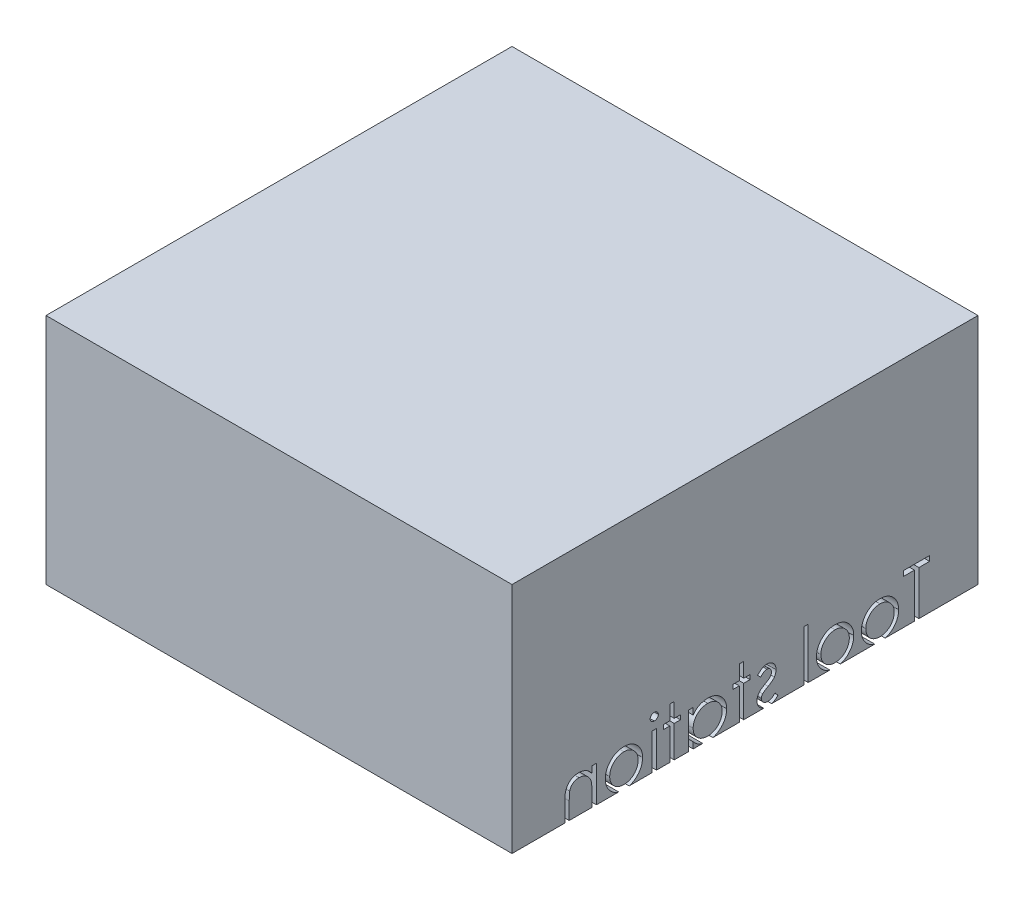
from build123d import *

# Parameters (mm, degrees)
SKETCH1_W           = 120
SKETCH1_H           = 60
BOSS_EXTRUDE1_DEPTH = 120
SKETCH2_W           = 1.13974359
SKETCH2_H           = 9.280769231
SKETCH2_H_2         = 13.025641026
CUT_EXTRUDE1_DEPTH  = 120


with BuildPart() as part:
    # Sketch1 → Boss-Extrude1 (new body)
    with BuildSketch(Plane(origin=(0, 0, 0), x_dir=(0, 0, -1), z_dir=(1, 0, 0))):
        Rectangle(SKETCH1_W, SKETCH1_H)
    extrude(amount=BOSS_EXTRUDE1_DEPTH)

    # Sketch2 → Cut-Extrude1 (cut)
    # profile 1 of 12: a face of its own
    with BuildSketch(Plane.ZY):
        with BuildLine():
            Line((38.262820513, -20.719230769), (39.402564103, -20.719230769))
            Line((39.402564103, -20.719230769), (39.402564103, -22.393229167))
            add(Edge.make_bspline(
                [(39.402564103, -22.393229167), (39.524257807, -22.241399858), (39.760408687, -21.946769788), (40.153688982, -21.55952656), (40.569319706, -21.240411029), (41.004755547, -20.986034405), (41.460587612, -20.794276648), (41.934037335, -20.655788841), (42.427939268, -20.572749606), (42.763815939, -20.561899341), (42.933733974, -20.556410256)],
                knots=[0, 0, 0, 0, 1.12780773, 2.188550248, 3.19190651, 4.159438251, 5.104880172, 6.052711206, 7.014878035, 8, 8, 8, 8], degree=3))
            add(Edge.make_bspline(
                [(42.933733974, -20.556410256), (43.105476561, -20.562742823), (43.44161823, -20.575137183), (43.93103291, -20.673169176), (44.388136367, -20.84061053), (44.811298755, -21.069980043), (45.192760358, -21.355209246), (45.527767676, -21.687505769), (45.804857173, -22.069725271), (45.990630462, -22.424320723), (46.113006384, -22.738877205), (46.190049437, -23.008286842), (46.255476141, -23.308435562), (46.312197055, -23.638416356), (46.350576861, -24.000541218), (46.380847462, -24.3933257), (46.402541581, -24.816642574), (46.403402304, -25.109419765), (46.403846154, -25.260396635)],
                knots=[0, 0, 0, 0, 1.235846778, 2.418850247, 3.575807741, 4.728682307, 5.871620074, 6.994088408, 8.11269785, 9.256955736, 9.865816715, 10.540099792, 11.271859618, 12.076849838, 12.949306005, 13.892391288, 14.913166135, 16, 16, 16, 16], degree=3))
            Line((46.403846154, -25.260396635), (46.403846154, -30))
            Line((46.403846154, -30), (45.264102564, -30))
            Line((45.264102564, -30), (45.264102564, -25.634375))
            add(Edge.make_bspline(
                [(45.264102564, -25.634375), (45.263401495, -25.508019271), (45.262060469, -25.266322266), (45.257830837, -24.920268954), (45.247635253, -24.606446226), (45.233308517, -24.32560435), (45.212338892, -24.078013001), (45.190485344, -23.863167911), (45.163761, -23.681341857), (45.139947001, -23.571885701), (45.129266827, -23.522796474)],
                knots=[0, 0, 0, 0, 1.430800155, 2.736877192, 3.918605307, 4.986035426, 5.920637409, 6.731861385, 7.431261377, 8, 8, 8, 8], degree=3))
            add(Edge.make_bspline(
                [(45.129266827, -23.522796474), (45.090711327, -23.378701603), (45.016503918, -23.101363558), (44.833137751, -22.725173765), (44.601583438, -22.40514034), (44.318925527, -22.14324195), (43.98789431, -21.939422057), (43.609408392, -21.798002279), (43.187120181, -21.709551245), (42.890105707, -21.700744223), (42.735296474, -21.696153846)],
                knots=[0, 0, 0, 0, 1.084156227, 2.086665306, 3.027808233, 3.945421172, 4.874247719, 5.839848303, 6.874090471, 8, 8, 8, 8], degree=3))
            add(Edge.make_bspline(
                [(42.735296474, -21.696153846), (42.64361088, -21.697881063), (42.462167456, -21.701299181), (42.193108987, -21.735593891), (41.932126987, -21.791686001), (41.676602229, -21.867409343), (41.431645377, -21.971412434), (41.189386378, -22.089447577), (40.958947548, -22.236579661), (40.735415221, -22.400557059), (40.527451605, -22.582273039), (40.33394592, -22.774023119), (40.161450818, -22.978223167), (40.005173053, -23.191582976), (39.870269069, -23.417032789), (39.752510721, -23.652397558), (39.652595485, -23.897987069), (39.602946858, -24.068439434), (39.578104968, -24.153725962)],
                knots=[0, 0, 0, 0, 1.023777757, 2.026029729, 3.023749952, 4.003683103, 4.997618607, 5.993177895, 7.010360494, 8.046726602, 9.087585522, 10.09234134, 11.086953743, 12.070360549, 13.043493632, 14.017870808, 15.008233677, 16, 16, 16, 16], degree=3))
            add(Edge.make_bspline(
                [(39.578104968, -24.153725962), (39.563809672, -24.216337698), (39.53268956, -24.352640174), (39.49907745, -24.576321353), (39.468569962, -24.835074691), (39.443035855, -25.128598241), (39.427413344, -25.457919674), (39.41037939, -25.821632571), (39.40417794, -26.221187229), (39.403117112, -26.499359657), (39.402564103, -26.644370994)],
                knots=[0, 0, 0, 0, 0.615963638, 1.340920617, 2.168419149, 3.115676021, 4.16674242, 5.331190069, 6.6087489, 8, 8, 8, 8], degree=3))
            Line((39.402564103, -26.644370994), (39.402564103, -30))
            Line((39.402564103, -30), (38.262820513, -30))
            Line((38.262820513, -30), (38.262820513, -20.719230769))
        make_face()
    # profile 2 of 12: a face of its own
    with BuildSketch(Plane.ZY):
        with BuildLine():
            add(Edge.make_bspline(
                [(31.185216346, -20.556410256), (31.359356108, -20.560118261), (31.700801622, -20.567388753), (32.20084738, -20.645094486), (32.678168301, -20.763920636), (33.134592484, -20.928191733), (33.564274471, -21.148380525), (33.973472985, -21.41112281), (34.361066132, -21.722391078), (34.593378266, -21.963176069), (34.711298077, -22.085396635)],
                knots=[0, 0, 0, 0, 1.054011418, 2.066658804, 3.057071809, 4.030435133, 4.997543892, 5.974964718, 6.972108034, 8, 8, 8, 8], degree=3))
            add(Edge.make_bspline(
                [(34.711298077, -22.085396635), (34.812832596, -22.202287383), (35.013936661, -22.433806722), (35.271803698, -22.809202803), (35.493950502, -23.197968311), (35.671978961, -23.605265754), (35.812350332, -24.02753956), (35.912011573, -24.466241144), (35.971291308, -24.920401661), (35.979284931, -25.228844159), (35.983333333, -25.38505609)],
                knots=[0, 0, 0, 0, 1.025258237, 2.030674902, 3.01204498, 3.988269485, 4.97094183, 5.956517959, 6.965070386, 8, 8, 8, 8], degree=3))
            add(Edge.make_bspline(
                [(35.983333333, -25.38505609), (35.979772481, -25.542173442), (35.97273607, -25.852644657), (35.906174948, -26.309914927), (35.802647865, -26.75330757), (35.654486623, -27.180966258), (35.464501484, -27.594198232), (35.232669561, -27.991198597), (34.957363978, -28.372750623), (34.645292333, -28.735614436), (34.300389811, -29.07004613), (33.926225501, -29.361522994), (33.530152293, -29.611246811), (33.106903554, -29.812401804), (32.660344388, -29.971005574), (32.189511598, -30.082402777), (31.695136628, -30.149755172), (31.357580711, -30.158404138), (31.185216346, -30.162820513)],
                knots=[0, 0, 0, 0, 0.998656419, 1.973391657, 2.932242238, 3.890759089, 4.846373663, 5.82037756, 6.809684879, 7.83454468, 8.860553229, 9.859544525, 10.845671541, 11.83227036, 12.833544569, 13.85385346, 14.904124723, 16, 16, 16, 16], degree=3))
            add(Edge.make_bspline(
                [(31.185216346, -30.162820513), (31.012007507, -30.158389315), (30.672769244, -30.149710591), (30.176649253, -30.08266445), (29.704972636, -29.971056914), (29.257828864, -29.811880583), (28.832760419, -29.611240381), (28.434392273, -29.362277965), (28.059924008, -29.069959687), (27.714948522, -28.735637858), (27.40289644, -28.372744588), (27.127585809, -27.991200163), (26.895755197, -27.594197824), (26.705769715, -27.180966367), (26.557608565, -26.75330754), (26.454081457, -26.309914935), (26.387520342, -25.852644655), (26.38048393, -25.542173441), (26.376923077, -25.38505609)],
                knots=[0, 0, 0, 0, 1.099876186, 2.154163076, 3.173186993, 4.173200201, 5.163417411, 6.152872554, 7.150605724, 8.17532212, 9.198891216, 10.186952605, 11.159729845, 12.11414092, 13.071450619, 14.029093627, 15.002601286, 16, 16, 16, 16], degree=3))
            add(Edge.make_bspline(
                [(26.376923077, -25.38505609), (26.380999089, -25.229693195), (26.389068892, -24.922101363), (26.448289025, -24.4687946), (26.547561501, -24.030835503), (26.68810114, -23.610191633), (26.867770547, -23.20467905), (27.086795791, -22.814952949), (27.347293229, -22.441254359), (27.547597454, -22.21003424), (27.648958333, -22.093028846)],
                knots=[0, 0, 0, 0, 1.031353054, 2.041901799, 3.029428768, 4.008703097, 4.981709435, 5.96992636, 6.972712378, 8, 8, 8, 8], degree=3))
            add(Edge.make_bspline(
                [(27.648958333, -22.093028846), (27.766700364, -21.969748352), (27.998260784, -21.727295569), (28.38778331, -21.416934696), (28.795975175, -21.148724942), (29.230405622, -20.932911246), (29.686454849, -20.762954339), (30.166221815, -20.644788041), (30.6679644, -20.567668724), (31.011080739, -20.560200479), (31.185216346, -20.556410256)],
                knots=[0, 0, 0, 0, 1.027980169, 2.021703884, 2.998553061, 3.971491411, 4.943284454, 5.930300938, 6.949603206, 8, 8, 8, 8], degree=3))
        make_face()
        with BuildLine():
            add(Edge.make_bspline(
                [(31.180128205, -21.696153846), (31.056983158, -21.699653936), (30.813872034, -21.706563761), (30.456023827, -21.759119644), (30.111526697, -21.842386302), (29.779727063, -21.960692449), (29.461743837, -22.11345131), (29.157272577, -22.301078789), (28.865417723, -22.521089802), (28.591888522, -22.773140068), (28.340855561, -23.04847242), (28.121406903, -23.341836465), (27.934807231, -23.648473778), (27.779358654, -23.96870323), (27.663581143, -24.305769989), (27.579496176, -24.655856851), (27.526989875, -25.019677077), (27.520145015, -25.2670042), (27.516666667, -25.392688301)],
                knots=[0, 0, 0, 0, 1.021534396, 2.016698045, 2.994645724, 3.958388632, 4.93408049, 5.916473867, 6.921342795, 7.962252576, 8.998418191, 10.008913653, 10.997312074, 11.973003931, 12.956656626, 13.948281152, 14.957379055, 16, 16, 16, 16], degree=3))
            add(Edge.make_bspline(
                [(27.516666667, -25.392688301), (27.522497141, -25.555074228), (27.534069542, -25.877379928), (27.6281774, -26.352037431), (27.785607616, -26.807720151), (27.998195745, -27.241756752), (28.264555453, -27.643339018), (28.578379952, -28.001375547), (28.93630115, -28.310478348), (29.334052451, -28.566948845), (29.763509547, -28.77072853), (30.218011055, -28.915141956), (30.692050145, -29.00901924), (31.016011655, -29.018350018), (31.180128205, -29.023076923)],
                knots=[0, 0, 0, 0, 1.016792936, 2.018143844, 3.017858371, 4.030088057, 5.03801393, 6.028138512, 7.003788237, 7.991172063, 8.984598303, 9.972568034, 10.972917682, 12, 12, 12, 12], degree=3))
            add(Edge.make_bspline(
                [(31.180128205, -29.023076923), (31.344235315, -29.018322478), (31.668178192, -29.008937334), (32.141558634, -28.91561476), (32.594817903, -28.770095762), (33.023828938, -28.567178029), (33.421399185, -28.30950441), (33.781894568, -28.003120985), (34.093039528, -27.642390724), (34.359135752, -27.241224834), (34.575205361, -26.808393042), (34.731898693, -26.351953328), (34.82623279, -25.877401347), (34.837774655, -25.555081404), (34.843589744, -25.392688301)],
                knots=[0, 0, 0, 0, 1.02726834, 2.027799167, 3.010890988, 4.004497153, 4.992059811, 5.971914811, 6.958719428, 7.966827853, 8.981595046, 9.981490638, 10.983022906, 12, 12, 12, 12], degree=3))
            add(Edge.make_bspline(
                [(34.843589744, -25.392688301), (34.840112592, -25.267003449), (34.83327009, -25.019674847), (34.780746647, -24.655865373), (34.696725118, -24.305738722), (34.580713821, -23.968818596), (34.425940685, -23.647644652), (34.235742607, -23.342736785), (34.017190029, -23.047456175), (33.763127905, -22.774030107), (33.489884219, -22.520991546), (33.197911081, -22.300993476), (32.893891301, -22.114275915), (32.576831873, -21.959385842), (32.244989699, -21.843462636), (31.900975259, -21.758638858), (31.544653863, -21.706785859), (31.302413906, -21.699720517), (31.180128205, -21.696153846)],
                knots=[0, 0, 0, 0, 1.042956736, 2.052379634, 3.044323526, 4.02829302, 5.004299113, 5.996692471, 7.007513377, 8.048758398, 9.090003419, 10.095195979, 11.07790575, 12.047570684, 13.018257071, 13.989683339, 14.985167495, 16, 16, 16, 16], degree=3))
        make_face(mode=Mode.SUBTRACT)
    # profile 3 of 12: a face of its own
    with BuildSketch(Plane.ZY):
        with BuildLine():
            add(Edge.make_bspline(
                [(23.359655449, -16.811538462), (23.43038108, -16.814819243), (23.568875451, -16.821243643), (23.769148165, -16.876258146), (23.951509323, -16.96951129), (24.113262811, -17.094623275), (24.252062514, -17.241759827), (24.349238234, -17.413249627), (24.411694643, -17.598519544), (24.419236829, -17.727751439), (24.423076923, -17.793549679)],
                knots=[0, 0, 0, 0, 1.055194115, 2.066272739, 3.074728998, 4.095836921, 5.109056067, 6.073838105, 7.019297344, 8, 8, 8, 8], degree=3))
            add(Edge.make_bspline(
                [(24.423076923, -17.793549679), (24.419150229, -17.857639878), (24.411387619, -17.984338616), (24.349286476, -18.166396643), (24.251234356, -18.335503615), (24.113351814, -18.482354477), (23.951485739, -18.607397299), (23.76915443, -18.70066878), (23.568873803, -18.755678421), (23.430380523, -18.762103492), (23.359655449, -18.765384615)],
                knots=[0, 0, 0, 0, 0.96129708, 1.900370562, 2.859976407, 3.87933698, 4.906634145, 5.921202961, 6.938410037, 8, 8, 8, 8], degree=3))
            add(Edge.make_bspline(
                [(23.359655449, -18.765384615), (23.289739136, -18.762228773), (23.153656168, -18.756086339), (22.956382197, -18.699589418), (22.775575964, -18.607365381), (22.613507009, -18.483173224), (22.478414594, -18.33460174), (22.380086385, -18.166499845), (22.318128666, -17.984312341), (22.310346728, -17.857631052), (22.306410256, -17.793549679)],
                knots=[0, 0, 0, 0, 1.054934014, 2.053291228, 3.073705704, 4.106921865, 5.123545215, 6.088680038, 7.033164197, 8, 8, 8, 8], degree=3))
            add(Edge.make_bspline(
                [(22.306410256, -17.793549679), (22.310260485, -17.727760597), (22.317822577, -17.598546687), (22.380132827, -17.41314471), (22.477595558, -17.242668975), (22.61359646, -17.09380502), (22.775552159, -16.969543014), (22.956388348, -16.877337453), (23.153654543, -16.820835735), (23.289738584, -16.814693963), (23.359655449, -16.811538462)],
                knots=[0, 0, 0, 0, 0.98631895, 1.937192651, 2.907499808, 3.917963147, 4.944918757, 5.95915025, 6.951458133, 8, 8, 8, 8], degree=3))
        make_face()
    # profile 4 of 12: a face of its own
    with BuildSketch(Plane.ZY):
        with Locations((23.36474359, -25.359615385)):
            Rectangle(SKETCH2_W, SKETCH2_H)
    # profile 5 of 12: a face of its own
    with BuildSketch(Plane.ZY):
        Polygon((18.235897436, -16.974358974), (19.375641026, -16.974358974), (19.375641026, -20.719230769), (21.003846154, -20.719230769), (21.003846154, -21.858974359), (19.375641026, -21.858974359), (19.375641026, -30), (18.235897436, -30), (18.235897436, -21.858974359), (16.607692308, -21.858974359), (16.607692308, -20.719230769), (18.235897436, -20.719230769), align=None)
    # profile 6 of 12: a face of its own
    with BuildSketch(Plane.ZY):
        with BuildLine():
            Line((14.491025641, -20.719230769), (14.491025641, -30))
            Line((14.491025641, -30), (13.351282051, -30))
            Line((13.351282051, -30), (13.351282051, -28.394691506))
            add(Edge.make_bspline(
                [(13.351282051, -28.394691506), (13.22276244, -28.539978033), (12.971954801, -28.823506517), (12.553068459, -29.193918971), (12.109046785, -29.500091738), (11.642044848, -29.747378575), (11.152484365, -29.933132608), (10.641450563, -30.065162385), (10.108734981, -30.150048587), (9.744962151, -30.158525009), (9.560616987, -30.162820513)],
                knots=[0, 0, 0, 0, 1.074387032, 2.096679803, 3.090159297, 4.057316773, 5.018401886, 5.985159533, 6.978961417, 8, 8, 8, 8], degree=3))
            add(Edge.make_bspline(
                [(9.560616987, -30.162820513), (9.39672184, -30.158370533), (9.073513354, -30.149594977), (8.598064988, -30.081514618), (8.140530255, -29.972183505), (7.700476805, -29.820143135), (7.280752163, -29.618464154), (6.87776267, -29.377014482), (6.493596044, -29.08948347), (6.134107889, -28.760778339), (5.803066059, -28.403745099), (5.512558012, -28.022942687), (5.270339694, -27.620017755), (5.067792544, -27.20007174), (4.911777237, -26.759871889), (4.803015764, -26.300940451), (4.735014715, -25.823820053), (4.726242786, -25.498919497), (4.721794872, -25.334174679)],
                knots=[0, 0, 0, 0, 1.033919861, 2.038935746, 3.024066025, 3.998881131, 4.97069526, 5.957263378, 6.95902576, 7.993208707, 9.027059324, 10.027763471, 11.009749337, 11.988697705, 12.965288445, 13.950418724, 14.960734635, 16, 16, 16, 16], degree=3))
            add(Edge.make_bspline(
                [(4.721794872, -25.334174679), (4.726341368, -25.172834955), (4.735329546, -24.853875024), (4.802288372, -24.384778034), (4.914886603, -23.932954631), (5.072903079, -23.499859437), (5.275529601, -23.084968397), (5.522011517, -22.687988078), (5.812366627, -22.307824836), (6.147111075, -21.953417813), (6.509731527, -21.62604587), (6.897657493, -21.341533048), (7.301239114, -21.095817625), (7.726736324, -20.901132154), (8.167851247, -20.743619117), (8.628510893, -20.634642347), (9.106798621, -20.570426353), (9.431521264, -20.56112718), (9.596233974, -20.556410256)],
                knots=[0, 0, 0, 0, 1.020392517, 2.01726096, 2.990465484, 3.961182959, 4.928053699, 5.906110375, 6.912531644, 7.948652711, 8.985773172, 9.998621852, 10.987621588, 11.969261332, 12.953316658, 13.946091881, 14.958173133, 16, 16, 16, 16], degree=3))
            add(Edge.make_bspline(
                [(9.596233974, -20.556410256), (9.785644892, -20.561627241), (10.157070761, -20.5718575), (10.700369537, -20.656993682), (11.214336643, -20.800824692), (11.702939577, -20.996468185), (12.164423781, -21.256450716), (12.594420324, -21.58440086), (12.997429363, -21.97825031), (13.23103785, -22.280765923), (13.351282051, -22.436478365)],
                knots=[0, 0, 0, 0, 1.038897134, 2.037228247, 3.008116434, 3.962042015, 4.918381754, 5.904844433, 6.921570401, 8, 8, 8, 8], degree=3))
            Line((13.351282051, -22.436478365), (13.351282051, -20.719230769))
            Line((13.351282051, -20.719230769), (14.491025641, -20.719230769))
        make_face()
        with BuildLine():
            add(Edge.make_bspline(
                [(9.611498397, -21.696153846), (9.444894943, -21.702081617), (9.116046223, -21.713782095), (8.633286558, -21.80512592), (8.171320742, -21.957107163), (7.732459272, -22.164958633), (7.3236346, -22.426320048), (6.958260423, -22.742446211), (6.633348336, -23.104711948), (6.36008692, -23.511482462), (6.137327116, -23.94755725), (5.980692458, -24.403394497), (5.87738976, -24.870772558), (5.866835985, -25.187774304), (5.861538462, -25.346895032)],
                knots=[0, 0, 0, 0, 1.031046209, 2.035121221, 3.029706178, 4.034933723, 5.034054252, 6.02443088, 7.017295772, 8.038157696, 9.050218397, 10.03989886, 11.016116709, 12, 12, 12, 12], degree=3))
            add(Edge.make_bspline(
                [(5.861538462, -25.346895032), (5.86830536, -25.50506485), (5.881812633, -25.820784512), (5.978879439, -26.288799748), (6.141729265, -26.744744415), (6.363950464, -27.184748591), (6.64221336, -27.593268041), (6.964752185, -27.962439343), (7.334686063, -28.279901563), (7.744451588, -28.545649331), (8.182086224, -28.760324763), (8.642312204, -28.909697227), (9.116478091, -29.006136602), (9.438885131, -29.017401418), (9.601322115, -29.023076923)],
                knots=[0, 0, 0, 0, 0.979072187, 1.954306742, 2.945804271, 3.96968567, 4.997920485, 5.998718438, 6.996577872, 8.005894225, 9.015743152, 10.005417472, 10.995077863, 12, 12, 12, 12], degree=3))
            add(Edge.make_bspline(
                [(9.601322115, -29.023076923), (9.766227997, -29.017053625), (10.094209439, -29.005073884), (10.578401322, -28.913339007), (11.048283044, -28.761777939), (11.497453845, -28.551686822), (11.915886663, -28.29131013), (12.291436105, -27.9864844), (12.608994047, -27.631961417), (12.878207231, -27.242338288), (13.089300885, -26.815211901), (13.243065443, -26.360427837), (13.33397533, -25.877970265), (13.345433377, -25.548264016), (13.351282051, -25.379967949)],
                knots=[0, 0, 0, 0, 1.01762866, 2.023962475, 3.030623092, 4.058876274, 5.077231937, 6.066672613, 7.034107872, 8.005628644, 8.981990164, 9.965428785, 10.961468474, 12, 12, 12, 12], degree=3))
            add(Edge.make_bspline(
                [(13.351282051, -25.379967949), (13.34779987, -25.251742107), (13.340945834, -24.999353071), (13.288583482, -24.628776079), (13.205289892, -24.274142273), (13.087919503, -23.935078801), (12.933736843, -23.613460317), (12.747780664, -23.30697753), (12.526780889, -23.017224449), (12.274295106, -22.74819102), (11.997924228, -22.502803571), (11.705481181, -22.283767612), (11.393501156, -22.103831208), (11.067230765, -21.954910023), (10.726103923, -21.836403964), (10.367344816, -21.757345761), (9.994766778, -21.703061168), (9.740599663, -21.698480529), (9.611498397, -21.696153846)],
                knots=[0, 0, 0, 0, 1.050140795, 2.067009409, 3.05949893, 4.030605086, 5.00011959, 5.97591094, 6.962425594, 7.979863591, 8.993523472, 9.986985069, 10.967611495, 11.937549037, 12.921786183, 13.919465291, 14.943216303, 16, 16, 16, 16], degree=3))
        make_face(mode=Mode.SUBTRACT)
    # profile 7 of 12: a face of its own
    with BuildSketch(Plane.ZY):
        Polygon((0.325641026, -16.974358974), (1.465384615, -16.974358974), (1.465384615, -20.719230769), (3.093589744, -20.719230769), (3.093589744, -21.858974359), (1.465384615, -21.858974359), (1.465384615, -30), (0.325641026, -30), (0.325641026, -21.858974359), (-1.302564103, -21.858974359), (-1.302564103, -20.719230769), (0.325641026, -20.719230769), align=None)
    # profile 8 of 12: a face of its own
    with BuildSketch(Plane.ZY):
        with BuildLine():
            Line((-3.256410256, -21.876782853), (-4.029807692, -22.673076923))
            add(Edge.make_bspline(
                [(-4.029807692, -22.673076923), (-4.096538948, -22.595740649), (-4.225188953, -22.446645418), (-4.429228898, -22.247302348), (-4.632514546, -22.079891169), (-4.832263098, -21.938550116), (-5.033497388, -21.831691784), (-5.23385592, -21.753696142), (-5.433546142, -21.70542959), (-5.567026899, -21.699208626), (-5.632572115, -21.696153846)],
                knots=[0, 0, 0, 0, 1.26578478, 2.440284043, 3.530471711, 4.527705817, 5.468200915, 6.346673037, 7.188140097, 8, 8, 8, 8], degree=3))
            add(Edge.make_bspline(
                [(-5.632572115, -21.696153846), (-5.712906473, -21.7000541), (-5.870993119, -21.707729246), (-6.09750966, -21.784340836), (-6.307787642, -21.901938259), (-6.489785827, -22.068738548), (-6.643955408, -22.260197466), (-6.756490765, -22.474269845), (-6.825310191, -22.704495603), (-6.834035933, -22.864261087), (-6.838461538, -22.945292468)],
                knots=[0, 0, 0, 0, 0.99966794, 1.967205029, 2.953328237, 3.988086729, 5.028030931, 6.008226631, 6.989793394, 8, 8, 8, 8], degree=3))
            add(Edge.make_bspline(
                [(-6.838461538, -22.945292468), (-6.834430877, -23.018633314), (-6.826380916, -23.165108259), (-6.763800108, -23.381182553), (-6.664137504, -23.591846663), (-6.57099137, -23.720889209), (-6.522996795, -23.787379808)],
                knots=[0, 0, 0, 0, 0.960159726, 1.917612774, 2.927026955, 4, 4, 4, 4], degree=3))
            add(Edge.make_bspline(
                [(-6.522996795, -23.787379808), (-6.494100689, -23.822883871), (-6.432598969, -23.898449795), (-6.317179501, -24.003329491), (-6.186469276, -24.11923423), (-6.029279788, -24.235119325), (-5.852383201, -24.357154442), (-5.651943512, -24.48053361), (-5.434321737, -24.614661666), (-5.278520653, -24.699731475), (-5.197536058, -24.743950321)],
                knots=[0, 0, 0, 0, 0.66740084, 1.420478572, 2.27185888, 3.217733974, 4.268547843, 5.408967954, 6.65319498, 8, 8, 8, 8], degree=3))
            add(Edge.make_bspline(
                [(-5.197536058, -24.743950321), (-5.098789649, -24.799267539), (-4.908044104, -24.906122191), (-4.637016063, -25.071983115), (-4.391045942, -25.236834283), (-4.168049663, -25.398912677), (-3.972317956, -25.562753082), (-3.797912294, -25.722075515), (-3.649182797, -25.881693862), (-3.565892835, -25.99321116), (-3.526081731, -26.046514423)],
                knots=[0, 0, 0, 0, 1.27191281, 2.456916733, 3.569705269, 4.599008579, 5.553216877, 6.436649441, 7.252746552, 8, 8, 8, 8], degree=3))
            add(Edge.make_bspline(
                [(-3.526081731, -26.046514423), (-3.460003531, -26.154159943), (-3.328495651, -26.368394505), (-3.190398512, -26.721158513), (-3.110351229, -27.095302336), (-3.099239744, -27.351233535), (-3.093589744, -27.481370192)],
                knots=[0, 0, 0, 0, 0.995354457, 1.980940102, 2.973342416, 4, 4, 4, 4], degree=3))
            add(Edge.make_bspline(
                [(-3.093589744, -27.481370192), (-3.096200623, -27.573061094), (-3.101345647, -27.753748033), (-3.137116347, -28.019848701), (-3.19863869, -28.274336953), (-3.282436026, -28.519974129), (-3.39559075, -28.75205371), (-3.528207043, -28.976430956), (-3.687410294, -29.188252191), (-3.869170428, -29.387239275), (-4.068181221, -29.568978987), (-4.280474923, -29.728723048), (-4.506312965, -29.861435643), (-4.744081645, -29.97125561), (-4.99432119, -30.058589003), (-5.257070725, -30.119050188), (-5.531495063, -30.155237064), (-5.718111795, -30.160260735), (-5.813201122, -30.162820513)],
                knots=[0, 0, 0, 0, 1.032770009, 2.035186124, 3.017557409, 3.978232242, 4.952395191, 5.920591857, 6.910227898, 7.931268572, 8.952309245, 9.941945286, 10.918353717, 11.897095711, 12.887975737, 13.898235213, 14.929059601, 16, 16, 16, 16], degree=3))
            add(Edge.make_bspline(
                [(-5.813201122, -30.162820513), (-5.941533444, -30.159218429), (-6.196414922, -30.152064311), (-6.573386188, -30.084913747), (-6.941761513, -29.980427603), (-7.298753216, -29.836315499), (-7.636377687, -29.654340055), (-7.945281327, -29.43639937), (-8.226537205, -29.189692808), (-8.386623513, -29.000597389), (-8.466666667, -28.906049679)],
                knots=[0, 0, 0, 0, 1.013940152, 2.01379169, 3.017749504, 4.037548394, 5.051665909, 6.043208538, 7.021604269, 8, 8, 8, 8], degree=3))
            Line((-8.466666667, -28.906049679), (-7.711077724, -28.046153846))
            add(Edge.make_bspline(
                [(-7.711077724, -28.046153846), (-7.639332112, -28.123641135), (-7.500242393, -28.27386196), (-7.277806549, -28.473884567), (-7.051458437, -28.64152918), (-6.823458288, -28.78174957), (-6.590431089, -28.889791748), (-6.353682717, -28.96569636), (-6.113694721, -29.014479571), (-5.952505828, -29.020206482), (-5.871714744, -29.023076923)],
                knots=[0, 0, 0, 0, 1.179806542, 2.287233372, 3.337373186, 4.324005949, 5.273901747, 6.200048787, 7.097828587, 8, 8, 8, 8], degree=3))
            add(Edge.make_bspline(
                [(-5.871714744, -29.023076923), (-5.761703984, -29.018102787), (-5.546761413, -29.00838416), (-5.238899774, -28.920147855), (-4.954642473, -28.781790601), (-4.707814905, -28.58554041), (-4.497712777, -28.357101618), (-4.345573402, -28.099784671), (-4.250228422, -27.821141385), (-4.239030656, -27.627984173), (-4.233333333, -27.529707532)],
                knots=[0, 0, 0, 0, 1.072336372, 2.095165389, 3.102688358, 4.141489647, 5.156069229, 6.117746104, 7.042326257, 8, 8, 8, 8], degree=3))
            add(Edge.make_bspline(
                [(-4.233333333, -27.529707532), (-4.23727503, -27.448755487), (-4.245057382, -27.288926511), (-4.306174398, -27.057603845), (-4.402741033, -26.838186741), (-4.497826471, -26.709772878), (-4.546254006, -26.644370994)],
                knots=[0, 0, 0, 0, 1.013901739, 2.00181326, 2.98231254, 4, 4, 4, 4], degree=3))
            add(Edge.make_bspline(
                [(-4.546254006, -26.644370994), (-4.575363838, -26.611585537), (-4.638775563, -26.54016697), (-4.755090296, -26.437024541), (-4.894361625, -26.32585201), (-5.05815593, -26.20853453), (-5.246803406, -26.086619591), (-5.461068645, -25.960746799), (-5.698016365, -25.824937622), (-5.865549798, -25.73487773), (-5.953125, -25.687800481)],
                knots=[0, 0, 0, 0, 0.615000592, 1.339693406, 2.178160186, 3.116406724, 4.166410947, 5.330106347, 6.604359322, 8, 8, 8, 8], degree=3))
            add(Edge.make_bspline(
                [(-5.953125, -25.687800481), (-6.047637094, -25.635044203), (-6.230926206, -25.532732944), (-6.490540662, -25.37338031), (-6.724755347, -25.211301913), (-6.939206003, -25.055589611), (-7.128475938, -24.898033614), (-7.291819522, -24.738459016), (-7.435667762, -24.583301352), (-7.515305514, -24.473365447), (-7.553345353, -24.420853365)],
                knots=[0, 0, 0, 0, 1.262093308, 2.447601706, 3.550203992, 4.582594899, 5.537233252, 6.418365656, 7.244515135, 8, 8, 8, 8], degree=3))
            add(Edge.make_bspline(
                [(-7.553345353, -24.420853365), (-7.619133528, -24.315096419), (-7.750732871, -24.10354557), (-7.878513707, -23.750447554), (-7.966347012, -23.378718346), (-7.974193399, -23.122226046), (-7.978205128, -22.991085737)],
                knots=[0, 0, 0, 0, 0.985009483, 1.970363186, 2.962279964, 4, 4, 4, 4], degree=3))
            add(Edge.make_bspline(
                [(-7.978205128, -22.991085737), (-7.976266762, -22.905359293), (-7.972473106, -22.737580497), (-7.942196119, -22.491059635), (-7.887071909, -22.256842048), (-7.817929762, -22.031410288), (-7.721834288, -21.819131261), (-7.607004861, -21.617174152), (-7.472067634, -21.425818106), (-7.316607692, -21.248006741), (-7.145677865, -21.086501471), (-6.961002558, -20.945717879), (-6.76673517, -20.825589105), (-6.56205319, -20.724841237), (-6.344990331, -20.64863622), (-6.117063844, -20.596176566), (-5.878735082, -20.561141973), (-5.715808139, -20.55801021), (-5.632572115, -20.556410256)],
                knots=[0, 0, 0, 0, 1.087655834, 2.128696564, 3.144119009, 4.137814668, 5.115653402, 6.093965665, 7.082169637, 8.081268856, 9.086088321, 10.061021666, 11.022561449, 11.980240094, 12.950172527, 13.934149372, 14.944599409, 16, 16, 16, 16], degree=3))
            add(Edge.make_bspline(
                [(-5.632572115, -20.556410256), (-5.533903771, -20.560417436), (-5.334716166, -20.568506964), (-5.035886523, -20.632753327), (-4.737496967, -20.738464876), (-4.438780812, -20.884464923), (-4.141926333, -21.073393301), (-3.84432231, -21.301736759), (-3.542396029, -21.567993037), (-3.353868836, -21.771553084), (-3.256410256, -21.876782853)],
                knots=[0, 0, 0, 0, 0.845714091, 1.707292901, 2.609013841, 3.555613372, 4.552488639, 5.621697636, 6.770543573, 8, 8, 8, 8], degree=3))
        make_face()
    # profile 9 of 12: a face of its own
    with BuildSketch(Plane.ZY):
        with Locations((-15.712179487, -23.487179487)):
            Rectangle(SKETCH2_W, SKETCH2_H_2)
    # profile 10 of 12: a face of its own
    with BuildSketch(Plane.ZY):
        with BuildLine():
            add(Edge.make_bspline(
                [(-23.196834936, -20.556410256), (-23.022695174, -20.560118261), (-22.68124966, -20.567388753), (-22.181203902, -20.645094486), (-21.703882981, -20.763920636), (-21.247458798, -20.928191733), (-20.817776811, -21.148380525), (-20.408578297, -21.41112281), (-20.02098515, -21.722391078), (-19.788673016, -21.963176069), (-19.670753205, -22.085396635)],
                knots=[0, 0, 0, 0, 1.054011418, 2.066658804, 3.057071809, 4.030435133, 4.997543892, 5.974964718, 6.972108034, 8, 8, 8, 8], degree=3))
            add(Edge.make_bspline(
                [(-19.670753205, -22.085396635), (-19.569218686, -22.202287383), (-19.368114621, -22.433806722), (-19.110247584, -22.809202803), (-18.88810078, -23.197968311), (-18.710072321, -23.605265754), (-18.56970095, -24.02753956), (-18.470039709, -24.466241144), (-18.410759974, -24.920401661), (-18.402766351, -25.228844159), (-18.398717949, -25.38505609)],
                knots=[0, 0, 0, 0, 1.025258237, 2.030674902, 3.01204498, 3.988269485, 4.97094183, 5.956517959, 6.965070386, 8, 8, 8, 8], degree=3))
            add(Edge.make_bspline(
                [(-18.398717949, -25.38505609), (-18.402278801, -25.542173442), (-18.409315212, -25.852644657), (-18.475876334, -26.309914927), (-18.579403417, -26.75330757), (-18.727564659, -27.180966258), (-18.917549798, -27.594198232), (-19.149381721, -27.991198597), (-19.424687304, -28.372750623), (-19.736758949, -28.735614436), (-20.081661471, -29.07004613), (-20.455825781, -29.361522994), (-20.851898989, -29.611246811), (-21.275147728, -29.812401804), (-21.721706894, -29.971005574), (-22.192539684, -30.082402777), (-22.686914654, -30.149755172), (-23.024470571, -30.158404138), (-23.196834936, -30.162820513)],
                knots=[0, 0, 0, 0, 0.998656419, 1.973391657, 2.932242238, 3.890759089, 4.846373663, 5.82037756, 6.809684879, 7.83454468, 8.860553229, 9.859544525, 10.845671541, 11.83227036, 12.833544569, 13.85385346, 14.904124723, 16, 16, 16, 16], degree=3))
            add(Edge.make_bspline(
                [(-23.196834936, -30.162820513), (-23.370043775, -30.158389315), (-23.709282038, -30.149710591), (-24.205402029, -30.08266445), (-24.677078647, -29.971056914), (-25.124222418, -29.811880583), (-25.549290863, -29.611240381), (-25.947659009, -29.362277965), (-26.322127274, -29.069959687), (-26.66710276, -28.735637858), (-26.979154842, -28.372744588), (-27.254465473, -27.991200163), (-27.486296085, -27.594197824), (-27.676281567, -27.180966367), (-27.824442717, -26.75330754), (-27.927969825, -26.309914935), (-27.994530941, -25.852644655), (-28.001567352, -25.542173441), (-28.005128205, -25.38505609)],
                knots=[0, 0, 0, 0, 1.099876186, 2.154163076, 3.173186993, 4.173200201, 5.163417411, 6.152872554, 7.150605724, 8.17532212, 9.198891216, 10.186952605, 11.159729845, 12.11414092, 13.071450619, 14.029093627, 15.002601286, 16, 16, 16, 16], degree=3))
            add(Edge.make_bspline(
                [(-28.005128205, -25.38505609), (-28.001052193, -25.229693195), (-27.99298239, -24.922101363), (-27.933762257, -24.4687946), (-27.834489781, -24.030835503), (-27.693950142, -23.610191633), (-27.514280735, -23.20467905), (-27.295255491, -22.814952949), (-27.034758053, -22.441254359), (-26.834453828, -22.21003424), (-26.733092949, -22.093028846)],
                knots=[0, 0, 0, 0, 1.031353054, 2.041901799, 3.029428768, 4.008703097, 4.981709435, 5.96992636, 6.972712378, 8, 8, 8, 8], degree=3))
            add(Edge.make_bspline(
                [(-26.733092949, -22.093028846), (-26.615350918, -21.969748352), (-26.383790498, -21.727295569), (-25.994267972, -21.416934696), (-25.586076107, -21.148724942), (-25.15164566, -20.932911246), (-24.695596433, -20.762954339), (-24.215829467, -20.644788041), (-23.714086883, -20.567668724), (-23.370970543, -20.560200479), (-23.196834936, -20.556410256)],
                knots=[0, 0, 0, 0, 1.027980169, 2.021703884, 2.998553061, 3.971491411, 4.943284454, 5.930300938, 6.949603206, 8, 8, 8, 8], degree=3))
        make_face()
        with BuildLine():
            add(Edge.make_bspline(
                [(-23.201923077, -21.696153846), (-23.325068124, -21.699653936), (-23.568179248, -21.706563761), (-23.926027455, -21.759119644), (-24.270524585, -21.842386302), (-24.60232422, -21.960692449), (-24.920307445, -22.11345131), (-25.224778705, -22.301078789), (-25.516633559, -22.521089802), (-25.79016276, -22.773140068), (-26.041195721, -23.04847242), (-26.260644379, -23.341836465), (-26.447244051, -23.648473778), (-26.602692628, -23.96870323), (-26.718470139, -24.305769989), (-26.802555106, -24.655856851), (-26.855061407, -25.019677077), (-26.861906267, -25.2670042), (-26.865384615, -25.392688301)],
                knots=[0, 0, 0, 0, 1.021534396, 2.016698045, 2.994645724, 3.958388632, 4.93408049, 5.916473867, 6.921342795, 7.962252576, 8.998418191, 10.008913653, 10.997312074, 11.973003931, 12.956656626, 13.948281152, 14.957379055, 16, 16, 16, 16], degree=3))
            add(Edge.make_bspline(
                [(-26.865384615, -25.392688301), (-26.859554141, -25.555074228), (-26.84798174, -25.877379928), (-26.753873882, -26.352037431), (-26.596443666, -26.807720151), (-26.383855537, -27.241756752), (-26.117495829, -27.643339018), (-25.80367133, -28.001375547), (-25.445750132, -28.310478348), (-25.047998831, -28.566948845), (-24.618541735, -28.77072853), (-24.164040227, -28.915141956), (-23.690001137, -29.00901924), (-23.366039627, -29.018350018), (-23.201923077, -29.023076923)],
                knots=[0, 0, 0, 0, 1.016792936, 2.018143844, 3.017858371, 4.030088057, 5.03801393, 6.028138512, 7.003788237, 7.991172063, 8.984598303, 9.972568034, 10.972917682, 12, 12, 12, 12], degree=3))
            add(Edge.make_bspline(
                [(-23.201923077, -29.023076923), (-23.037815967, -29.018322478), (-22.71387309, -29.008937334), (-22.240492648, -28.91561476), (-21.787233379, -28.770095762), (-21.358222344, -28.567178029), (-20.960652098, -28.30950441), (-20.600156714, -28.003120985), (-20.289011754, -27.642390724), (-20.022915531, -27.241224834), (-19.806845921, -26.808393042), (-19.650152589, -26.351953328), (-19.555818492, -25.877401347), (-19.544276627, -25.555081404), (-19.538461538, -25.392688301)],
                knots=[0, 0, 0, 0, 1.02726834, 2.027799167, 3.010890988, 4.004497153, 4.992059811, 5.971914811, 6.958719428, 7.966827853, 8.981595046, 9.981490638, 10.983022906, 12, 12, 12, 12], degree=3))
            add(Edge.make_bspline(
                [(-19.538461538, -25.392688301), (-19.54193869, -25.267003449), (-19.548781192, -25.019674847), (-19.601304635, -24.655865373), (-19.685326164, -24.305738722), (-19.801337461, -23.968818596), (-19.956110597, -23.647644652), (-20.146308675, -23.342736785), (-20.364861253, -23.047456175), (-20.618923377, -22.774030107), (-20.892167063, -22.520991546), (-21.184140201, -22.300993476), (-21.488159981, -22.114275915), (-21.805219409, -21.959385842), (-22.137061583, -21.843462636), (-22.481076023, -21.758638858), (-22.837397419, -21.706785859), (-23.079637376, -21.699720517), (-23.201923077, -21.696153846)],
                knots=[0, 0, 0, 0, 1.042956736, 2.052379634, 3.044323526, 4.02829302, 5.004299113, 5.996692471, 7.007513377, 8.048758398, 9.090003419, 10.095195979, 11.07790575, 12.047570684, 13.018257071, 13.989683339, 14.985167495, 16, 16, 16, 16], degree=3))
        make_face(mode=Mode.SUBTRACT)
    # profile 11 of 12: a face of its own
    with BuildSketch(Plane.ZY):
        with BuildLine():
            add(Edge.make_bspline(
                [(-34.757091346, -20.556410256), (-34.582951585, -20.560118261), (-34.24150607, -20.567388753), (-33.741460313, -20.645094486), (-33.264139391, -20.763920636), (-32.807715208, -20.928191733), (-32.378033222, -21.148380525), (-31.968834707, -21.41112281), (-31.581241561, -21.722391078), (-31.348929426, -21.963176069), (-31.231009615, -22.085396635)],
                knots=[0, 0, 0, 0, 1.054011418, 2.066658804, 3.057071809, 4.030435133, 4.997543892, 5.974964718, 6.972108034, 8, 8, 8, 8], degree=3))
            add(Edge.make_bspline(
                [(-31.231009615, -22.085396635), (-31.129475096, -22.202287383), (-30.928371031, -22.433806722), (-30.670503994, -22.809202803), (-30.44835719, -23.197968311), (-30.270328732, -23.605265754), (-30.12995736, -24.02753956), (-30.030296119, -24.466241144), (-29.971016384, -24.920401661), (-29.963022761, -25.228844159), (-29.958974359, -25.38505609)],
                knots=[0, 0, 0, 0, 1.025258237, 2.030674902, 3.01204498, 3.988269485, 4.97094183, 5.956517959, 6.965070386, 8, 8, 8, 8], degree=3))
            add(Edge.make_bspline(
                [(-29.958974359, -25.38505609), (-29.962535212, -25.542173442), (-29.969571622, -25.852644657), (-30.036132745, -26.309914927), (-30.139659828, -26.75330757), (-30.287821069, -27.180966258), (-30.477806208, -27.594198232), (-30.709638132, -27.991198597), (-30.984943714, -28.372750623), (-31.297015359, -28.735614436), (-31.641917881, -29.07004613), (-32.016082191, -29.361522994), (-32.412155399, -29.611246811), (-32.835404138, -29.812401804), (-33.281963305, -29.971005574), (-33.752796095, -30.082402777), (-34.247171064, -30.149755172), (-34.584726982, -30.158404138), (-34.757091346, -30.162820513)],
                knots=[0, 0, 0, 0, 0.998656419, 1.973391657, 2.932242238, 3.890759089, 4.846373663, 5.82037756, 6.809684879, 7.83454468, 8.860553229, 9.859544525, 10.845671541, 11.83227036, 12.833544569, 13.85385346, 14.904124723, 16, 16, 16, 16], degree=3))
            add(Edge.make_bspline(
                [(-34.757091346, -30.162820513), (-34.930300186, -30.158389315), (-35.269538448, -30.149710591), (-35.765658439, -30.08266445), (-36.237335057, -29.971056914), (-36.684478829, -29.811880583), (-37.109547273, -29.611240381), (-37.507915419, -29.362277965), (-37.882383684, -29.069959687), (-38.22735917, -28.735637858), (-38.539411253, -28.372744588), (-38.814721883, -27.991200163), (-39.046552495, -27.594197824), (-39.236537978, -27.180966367), (-39.384699127, -26.75330754), (-39.488226235, -26.309914935), (-39.554787351, -25.852644655), (-39.561823762, -25.542173441), (-39.565384615, -25.38505609)],
                knots=[0, 0, 0, 0, 1.099876186, 2.154163076, 3.173186993, 4.173200201, 5.163417411, 6.152872554, 7.150605724, 8.17532212, 9.198891216, 10.186952605, 11.159729845, 12.11414092, 13.071450619, 14.029093627, 15.002601286, 16, 16, 16, 16], degree=3))
            add(Edge.make_bspline(
                [(-39.565384615, -25.38505609), (-39.561308604, -25.229693195), (-39.553238801, -24.922101363), (-39.494018668, -24.4687946), (-39.394746191, -24.030835503), (-39.254206553, -23.610191633), (-39.074537146, -23.20467905), (-38.855511901, -22.814952949), (-38.595014463, -22.441254359), (-38.394710239, -22.21003424), (-38.293349359, -22.093028846)],
                knots=[0, 0, 0, 0, 1.031353054, 2.041901799, 3.029428768, 4.008703097, 4.981709435, 5.96992636, 6.972712378, 8, 8, 8, 8], degree=3))
            add(Edge.make_bspline(
                [(-38.293349359, -22.093028846), (-38.175607329, -21.969748352), (-37.944046908, -21.727295569), (-37.554524382, -21.416934696), (-37.146332517, -21.148724942), (-36.711902071, -20.932911246), (-36.255852843, -20.762954339), (-35.776085877, -20.644788041), (-35.274343293, -20.567668724), (-34.931226953, -20.560200479), (-34.757091346, -20.556410256)],
                knots=[0, 0, 0, 0, 1.027980169, 2.021703884, 2.998553061, 3.971491411, 4.943284454, 5.930300938, 6.949603206, 8, 8, 8, 8], degree=3))
        make_face()
        with BuildLine():
            add(Edge.make_bspline(
                [(-34.762179487, -21.696153846), (-34.885324534, -21.699653936), (-35.128435658, -21.706563761), (-35.486283865, -21.759119644), (-35.830780995, -21.842386302), (-36.16258063, -21.960692449), (-36.480563855, -22.11345131), (-36.785035116, -22.301078789), (-37.076889969, -22.521089802), (-37.35041917, -22.773140068), (-37.601452132, -23.04847242), (-37.820900789, -23.341836465), (-38.007500461, -23.648473778), (-38.162949038, -23.96870323), (-38.278726549, -24.305769989), (-38.362811516, -24.655856851), (-38.415317817, -25.019677077), (-38.422162677, -25.2670042), (-38.425641026, -25.392688301)],
                knots=[0, 0, 0, 0, 1.021534396, 2.016698045, 2.994645724, 3.958388632, 4.93408049, 5.916473867, 6.921342795, 7.962252576, 8.998418191, 10.008913653, 10.997312074, 11.973003931, 12.956656626, 13.948281152, 14.957379055, 16, 16, 16, 16], degree=3))
            add(Edge.make_bspline(
                [(-38.425641026, -25.392688301), (-38.419810551, -25.555074228), (-38.40823815, -25.877379928), (-38.314130292, -26.352037431), (-38.156700077, -26.807720151), (-37.944111947, -27.241756752), (-37.67775224, -27.643339018), (-37.36392774, -28.001375547), (-37.006006542, -28.310478348), (-36.608255241, -28.566948845), (-36.178798145, -28.77072853), (-35.724296637, -28.915141956), (-35.250257547, -29.00901924), (-34.926296037, -29.018350018), (-34.762179487, -29.023076923)],
                knots=[0, 0, 0, 0, 1.016792936, 2.018143844, 3.017858371, 4.030088057, 5.03801393, 6.028138512, 7.003788237, 7.991172063, 8.984598303, 9.972568034, 10.972917682, 12, 12, 12, 12], degree=3))
            add(Edge.make_bspline(
                [(-34.762179487, -29.023076923), (-34.598072377, -29.018322478), (-34.2741295, -29.008937334), (-33.800749059, -28.91561476), (-33.347489789, -28.770095762), (-32.918478755, -28.567178029), (-32.520908508, -28.30950441), (-32.160413125, -28.003120985), (-31.849268164, -27.642390724), (-31.583171941, -27.241224834), (-31.367102331, -26.808393042), (-31.210408999, -26.351953328), (-31.116074902, -25.877401347), (-31.104533038, -25.555081404), (-31.098717949, -25.392688301)],
                knots=[0, 0, 0, 0, 1.02726834, 2.027799167, 3.010890988, 4.004497153, 4.992059811, 5.971914811, 6.958719428, 7.966827853, 8.981595046, 9.981490638, 10.983022906, 12, 12, 12, 12], degree=3))
            add(Edge.make_bspline(
                [(-31.098717949, -25.392688301), (-31.1021951, -25.267003449), (-31.109037603, -25.019674847), (-31.161561045, -24.655865373), (-31.245582575, -24.305738722), (-31.361593871, -23.968818596), (-31.516367007, -23.647644652), (-31.706565085, -23.342736785), (-31.925117663, -23.047456175), (-32.179179787, -22.774030107), (-32.452423473, -22.520991546), (-32.744396611, -22.300993476), (-33.048416391, -22.114275915), (-33.365475819, -21.959385842), (-33.697317993, -21.843462636), (-34.041332434, -21.758638858), (-34.39765383, -21.706785859), (-34.639893786, -21.699720517), (-34.762179487, -21.696153846)],
                knots=[0, 0, 0, 0, 1.042956736, 2.052379634, 3.044323526, 4.02829302, 5.004299113, 5.996692471, 7.007513377, 8.048758398, 9.090003419, 10.095195979, 11.07790575, 12.047570684, 13.018257071, 13.989683339, 14.985167495, 16, 16, 16, 16], degree=3))
        make_face(mode=Mode.SUBTRACT)
    # profile 12 of 12: a face of its own
    with BuildSketch(Plane.ZY):
        Polygon((-47.543589744, -18.602564103), (-47.543589744, -17.3), (-40.867948718, -17.3), (-40.867948718, -18.602564103), (-43.635897436, -18.602564103), (-43.635897436, -30), (-44.775641026, -30), (-44.775641026, -18.602564103), align=None)
    extrude(amount=-CUT_EXTRUDE1_DEPTH, mode=Mode.SUBTRACT)


with BuildPart() as cut_extrude1_piece_1:
    # of the separate pieces the step leaves, piece 1, a body of its own (cut_extrude1_pieces)
    add(part.part.solids().sort_by_distance((0, 30, -60))[0])


with BuildPart() as cut_extrude1_piece_2:
    # of the separate pieces the step leaves, piece 2, a body of its own (cut_extrude1_pieces)
    add(part.part.solids().sort_by_distance((0, -30, 45.264102564))[0])


with BuildPart() as cut_extrude1_piece_3:
    # of the separate pieces the step leaves, piece 3, a body of its own (cut_extrude1_pieces)
    add(part.part.solids().sort_by_distance((0, -21.696153846, 9.611498397))[0])


with BuildPart() as cut_extrude1_piece_4:
    # of the separate pieces the step leaves, piece 4, a body of its own (cut_extrude1_pieces)
    add(part.part.solids().sort_by_distance((0, -21.696153846, -23.201923077))[0])


with BuildPart() as cut_extrude1_piece_5:
    # of the separate pieces the step leaves, piece 5, a body of its own (cut_extrude1_pieces)
    add(part.part.solids().sort_by_distance((0, -21.696153846, 31.180128205))[0])


with BuildPart() as cut_extrude1_piece_6:
    # of the separate pieces the step leaves, piece 6, a body of its own (cut_extrude1_pieces)
    add(part.part.solids().sort_by_distance((0, -21.696153846, -34.762179487))[0])


with BuildPart() as cut_extrude1_piece_7:
    # of the separate pieces the step leaves, piece 7, a body of its own (cut_extrude1_pieces)
    add(part.part.solids().sort_by_distance((0, -30, 13.351282051))[0])


solid = Compound([cut_extrude1_piece_1.part, cut_extrude1_piece_2.part, cut_extrude1_piece_3.part, cut_extrude1_piece_4.part, cut_extrude1_piece_5.part, cut_extrude1_piece_6.part, cut_extrude1_piece_7.part])
